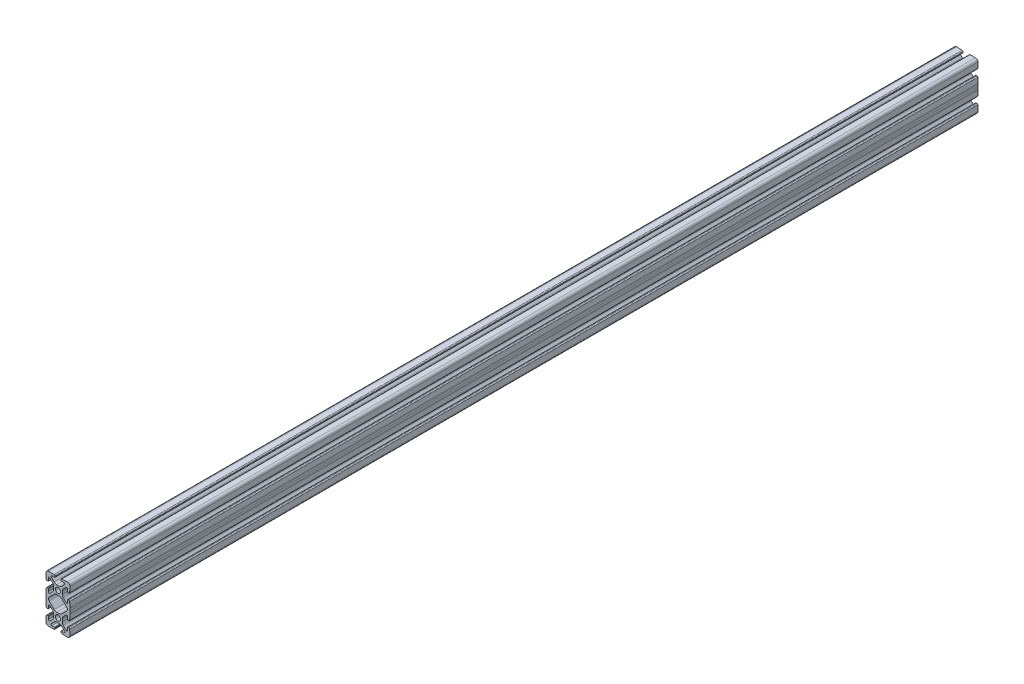
from build123d import *

# Parameters (mm, degrees)
SKETCH3_R               = 2.15
BOSS_EXTRUDE1_DEPTH     = 1524
CIRPATTERN1_COUNT       = 2
CUT_EXTRUDE1_DEPTH      = 10
CUT_EXTRUDE1_DEPTH_BACK = 21
SKETCH4_OUTSIDE_W       = 3659.666
SKETCH4_OUTSIDE_H       = 651.666
SKETCH4_OUTSIDE_W_2     = 760
SKETCH4_OUTSIDE_H_2     = 40


with BuildPart() as part:
    # Sketch3 → Boss-Extrude1 (new, symmetric)
    with BuildSketch(Plane.XY):
        with BuildLine():
            Line((-8.30911066, 7.475083014), (-9.008684239, 7.499512662))
            ThreePointArc((-9.008684239, 7.499512662), (-9.582202525, 7.285082961), (-9.836116498, 6.727919597))
            Line((-9.836116498, 6.727919597), (-9.986803685, 2.412803152))
            ThreePointArc((-9.986803685, 2.412803152), (-9.995837451, 2.069746735), (-9.99898368, 1.726585818))
            Line((-9.99898368, 1.726585818), (-10, 0))
            Line((-10, 0), (-7.916458339, 0))
            ThreePointArc((-7.916458339, 0), (-7.764217404, 0.765366865), (-7.330671901, 1.414213562))
            Line((-7.330671901, 1.414213562), (-3.22356512, 5.521320344))
            ThreePointArc((-3.22356512, 5.521320344), (-2.250295073, 6.171638598), (-1.102244776, 6.4))
            Line((-1.102244776, 6.4), (1.102244776, 6.4))
            ThreePointArc((1.102244776, 6.4), (2.250295073, 6.171638598), (3.22356512, 5.521320344))
            Line((3.22356512, 5.521320344), (7.330671901, 1.414213562))
            ThreePointArc((7.330671901, 1.414213562), (7.764217404, 0.765366865), (7.916458339, 0))
            Line((7.916458339, 0), (10, 0))
            Line((10, 0), (9.99898368, 1.726585818))
            ThreePointArc((9.99898368, 1.726585818), (9.995837451, 2.069746735), (9.986803685, 2.412803152))
            Line((9.986803685, 2.412803152), (9.836116498, 6.727919597))
            ThreePointArc((9.836116498, 6.727919597), (9.582202525, 7.285082961), (9.008684239, 7.499512662))
            Line((9.008684239, 7.499512662), (8.30911066, 7.475083014))
            ThreePointArc((8.30911066, 7.475083014), (8.100174399, 7.379865274), (8.019763261, 7.164795917))
            Line((8.019763261, 7.164795917), (8.093719461, 5.046967452))
            ThreePointArc((8.093719461, 5.046967452), (7.631170264, 4.313871343), (6.779559917, 4.47555462))
            Line((6.779559917, 4.47555462), (4.478679656, 6.77643488))
            ThreePointArc((4.478679656, 6.77643488), (3.828361402, 7.749704927), (3.6, 8.897755224))
            Line((3.6, 8.897755224), (3.6, 11.102244776))
            ThreePointArc((3.6, 11.102244776), (3.828361402, 12.250295073), (4.478679656, 13.22356512))
            Line((4.478679656, 13.22356512), (6.779559917, 15.52444538))
            ThreePointArc((6.779559917, 15.52444538), (7.631170264, 15.686128657), (8.093719461, 14.953032548))
            Line((8.093719461, 14.953032548), (8.019763261, 12.835204083))
            ThreePointArc((8.019763261, 12.835204083), (8.100174399, 12.620134726), (8.30911066, 12.524916986))
            Line((8.30911066, 12.524916986), (9.008684239, 12.500487338))
            ThreePointArc((9.008684239, 12.500487338), (9.582202525, 12.714917039), (9.836116498, 13.272080403))
            Line((9.836116498, 13.272080403), (9.998781654, 17.930201007))
            ThreePointArc((9.998781654, 17.930201007), (9.414213562, 19.414213562), (7.930201007, 19.998781654))
            Line((7.930201007, 19.998781654), (3.272080403, 19.836116498))
            ThreePointArc((3.272080403, 19.836116498), (2.714917039, 19.582202525), (2.500487338, 19.008684239))
            Line((2.500487338, 19.008684239), (2.524916986, 18.30911066))
            ThreePointArc((2.524916986, 18.30911066), (2.620134726, 18.100174399), (2.835204083, 18.019763261))
            Line((2.835204083, 18.019763261), (4.953032548, 18.093719461))
            ThreePointArc((4.953032548, 18.093719461), (5.686128657, 17.631170264), (5.52444538, 16.779559917))
            Line((5.52444538, 16.779559917), (3.22356512, 14.478679656))
            ThreePointArc((3.22356512, 14.478679656), (2.250295073, 13.828361402), (1.102244776, 13.6))
            Line((1.102244776, 13.6), (-1.102244776, 13.6))
            ThreePointArc((-1.102244776, 13.6), (-2.250295073, 13.828361402), (-3.22356512, 14.478679656))
            Line((-3.22356512, 14.478679656), (-5.52444538, 16.779559917))
            ThreePointArc((-5.52444538, 16.779559917), (-5.686128657, 17.631170264), (-4.953032548, 18.093719461))
            Line((-4.953032548, 18.093719461), (-2.835204083, 18.019763261))
            ThreePointArc((-2.835204083, 18.019763261), (-2.620134726, 18.100174399), (-2.524916986, 18.30911066))
            Line((-2.524916986, 18.30911066), (-2.500487338, 19.008684239))
            ThreePointArc((-2.500487338, 19.008684239), (-2.714917039, 19.582202525), (-3.272080403, 19.836116498))
            Line((-3.272080403, 19.836116498), (-7.930201007, 19.998781654))
            ThreePointArc((-7.930201007, 19.998781654), (-9.414213562, 19.414213562), (-9.998781654, 17.930201007))
            Line((-9.998781654, 17.930201007), (-9.836116498, 13.272080403))
            ThreePointArc((-9.836116498, 13.272080403), (-9.582202525, 12.714917039), (-9.008684239, 12.500487338))
            Line((-9.008684239, 12.500487338), (-8.30911066, 12.524916986))
            ThreePointArc((-8.30911066, 12.524916986), (-8.100174399, 12.620134726), (-8.019763261, 12.835204083))
            Line((-8.019763261, 12.835204083), (-8.093719461, 14.953032548))
            ThreePointArc((-8.093719461, 14.953032548), (-7.631170264, 15.686128657), (-6.779559917, 15.52444538))
            Line((-6.779559917, 15.52444538), (-4.478679656, 13.22356512))
            ThreePointArc((-4.478679656, 13.22356512), (-3.828361402, 12.250295073), (-3.6, 11.102244776))
            Line((-3.6, 11.102244776), (-3.6, 8.897755224))
            ThreePointArc((-3.6, 8.897755224), (-3.828361402, 7.749704927), (-4.478679656, 6.77643488))
            Line((-4.478679656, 6.77643488), (-6.779559917, 4.47555462))
            ThreePointArc((-6.779559917, 4.47555462), (-7.631170264, 4.313871343), (-8.093719461, 5.046967452))
            Line((-8.093719461, 5.046967452), (-8.019763261, 7.164795917))
            ThreePointArc((-8.019763261, 7.164795917), (-8.100174399, 7.379865274), (-8.30911066, 7.475083014))
        make_face()
        with Locations((0, 10)):
            Circle(SKETCH3_R, mode=Mode.SUBTRACT)
    boss_extrude1 = extrude(amount=BOSS_EXTRUDE1_DEPTH, both=True)

    # CirPattern1: Boss-Extrude1 ×2 about axis
    cirpattern1_axis = Axis((0, 0, 0), (0, 0, 1))
    for i in range(1, CIRPATTERN1_COUNT):
        add(boss_extrude1.rotate(cirpattern1_axis, i * 360 / CIRPATTERN1_COUNT))

    # Sketch4 outside → Cut-Extrude1 (cut, two sides: drawn at the far end of the back side and taken through both)
    with BuildSketch(Plane(origin=(3.6, 0, 0), x_dir=(0, 0, -1), z_dir=(1, 0, 0)).offset(-CUT_EXTRUDE1_DEPTH_BACK)):
        Rectangle(SKETCH4_OUTSIDE_W, SKETCH4_OUTSIDE_H)
        with Locations((-1144, 0)):
            Rectangle(SKETCH4_OUTSIDE_W_2, SKETCH4_OUTSIDE_H_2, mode=Mode.SUBTRACT)
    extrude(amount=CUT_EXTRUDE1_DEPTH + CUT_EXTRUDE1_DEPTH_BACK, mode=Mode.SUBTRACT)


solid = part.part
